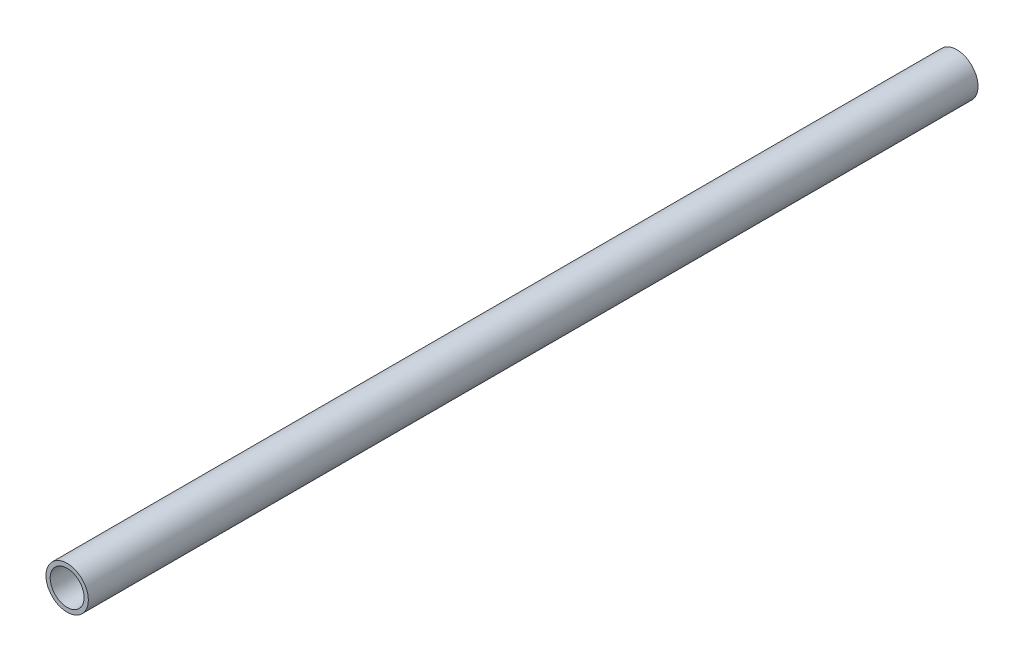
from build123d import *

# Parameters (mm, degrees)
SKETCH_1_R          = 5
EXTRUDE_1_DEPTH     = 210
SHELL_1_T           = -1
CUT_EXTRUDE_1_REACH = 211.12
SKETCH_2_R          = 4


with BuildPart() as part:
    # 草图1 → 凸台-拉伸1 (new body)
    with BuildSketch(Plane.XY):
        Circle(SKETCH_1_R)
    extrude(amount=EXTRUDE_1_DEPTH)

    # 抽壳1
    shell_1_openings = [part.faces().sort_by_distance(p)[0] for p in [
        (0, 0, 210),
    ]]
    offset(amount=SHELL_1_T, openings=shell_1_openings, kind=Kind.INTERSECTION)

    # 草图2 → 切除-拉伸1 (cut, up to next)
    with BuildSketch(Plane.XY.offset(1), mode=Mode.PRIVATE) as cut_extrude_1_sk1:
        Circle(SKETCH_2_R)
    cut_extrude_1_tool1 = extrude(cut_extrude_1_sk1.sketch, amount=-CUT_EXTRUDE_1_REACH, mode=Mode.PRIVATE) & part.part
    add(cut_extrude_1_tool1.solids().sort_by_distance((0, 0, 1))[0], mode=Mode.SUBTRACT)


solid = part.part
